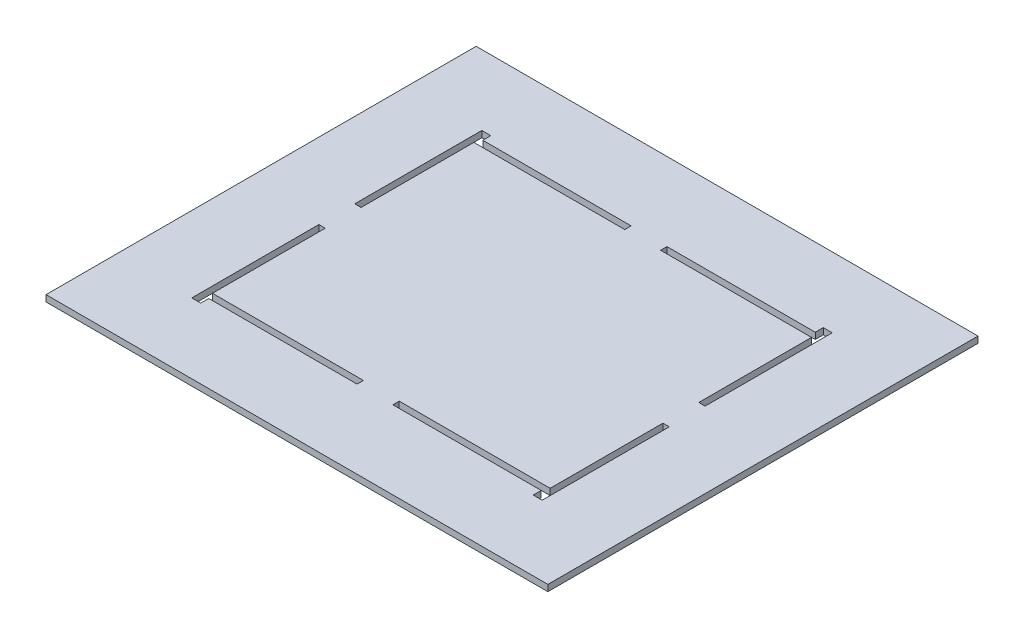
from build123d import *

# Parameters (mm, degrees)
SKETCH2_W           = 355.6
SKETCH2_H           = 304.8
BOSS_EXTRUDE1_DEPTH = 4.4958
CUT_EXTRUDE3_DEPTH  = 6.35


with BuildPart() as part:
    # Sketch2 → Boss-Extrude1 (new body)
    with BuildSketch(Plane(origin=(0, 0, 0), x_dir=(1, 0, 0), z_dir=(0, 1, 0))):
        with Locations((177.8, 152.4)):
            Rectangle(SKETCH2_W, SKETCH2_H)
    extrude(amount=BOSS_EXTRUDE1_DEPTH)

    # Sketch3 → Cut-Extrude3 (cut)
    with BuildSketch(Plane(origin=(0, 4.4958, 0), x_dir=(1, 0, 0), z_dir=(0, 1, 0))):
        Polygon((60.0075, 49.6443), (60.0075, 55.3085), (165.1, 55.3085), (165.1, 59.8043), (58.1533, 59.8043), (58.1533, 139.7), (53.6575, 139.7), (53.6575, 49.6443), align=None)
        Polygon((190.5, 59.8043), (190.5, 55.3085), (295.5925, 55.3085), (295.5925, 49.6443), (301.9425, 49.6443), (301.9425, 139.7), (297.4467, 139.7), (297.4467, 59.8043), align=None)
        Polygon((53.6575, 165.1), (58.1533, 165.1), (58.1533, 244.9957), (165.1, 244.9957), (165.1, 249.4915), (60.0075, 249.4915), (60.0075, 255.1557), (53.6575, 255.1557), align=None)
        Polygon((297.4467, 244.9957), (297.4467, 165.1), (301.9425, 165.1), (301.9425, 255.1557), (295.5925, 255.1557), (295.5925, 249.4915), (190.5, 249.4915), (190.5, 244.9957), align=None)
    extrude(amount=-CUT_EXTRUDE3_DEPTH, mode=Mode.SUBTRACT)


solid = part.part
